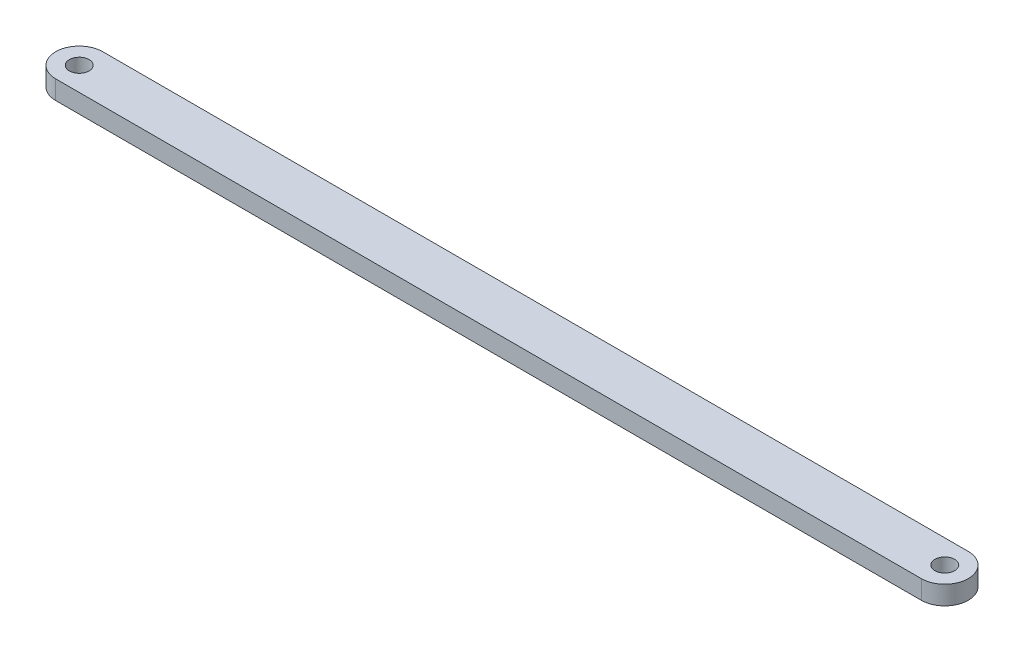
from build123d import *

# Parameters (mm, degrees)
SKETCH1_R           = 1.05
BOSS_EXTRUDE1_DEPTH = 2


with BuildPart() as part:
    # Sketch1 → Boss-Extrude1 (new body)
    with BuildSketch(Plane(origin=(0, 0, 0), x_dir=(1, 0, 0), z_dir=(0, 1, 0))):
        with BuildLine():
            Line((0, 2.5), (92, 2.5))
            ThreePointArc((92, 2.5), (94.5, 0), (92, -2.5))
            Line((92, -2.5), (0, -2.5))
            ThreePointArc((0, -2.5), (-2.5, 0), (0, 2.5))
        make_face()
        with Locations(Location((0, 0, 0), (0, 0, 270))):
            Circle(SKETCH1_R, mode=Mode.SUBTRACT)
        with Locations(Location((92, 0, 0), (0, 0, 270))):
            Circle(SKETCH1_R, mode=Mode.SUBTRACT)
    extrude(amount=BOSS_EXTRUDE1_DEPTH)


solid = part.part
